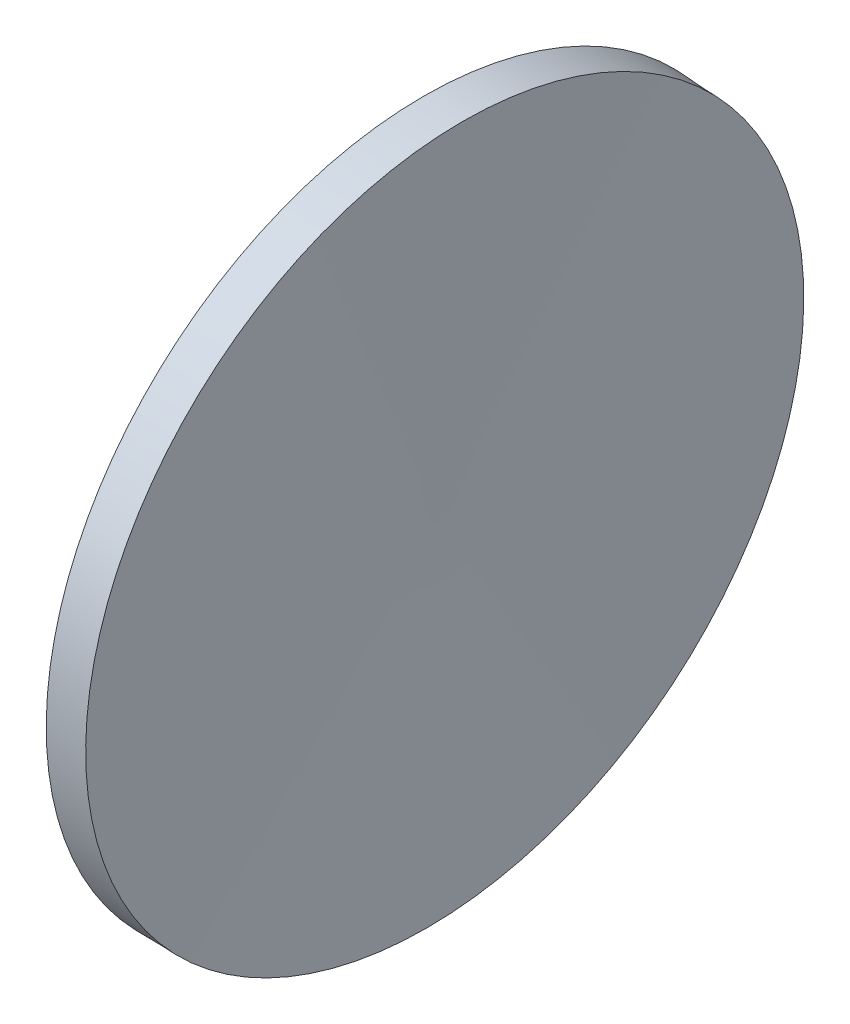
from build123d import *


with BuildPart() as part:
    # 草图1 → 旋转1 (revolve)
    with BuildSketch(Plane.XY):
        with BuildLine():
            Line((-115.589360424, 0.247109473), (-115.056821335, 0.220545144))
            Line((-115.056821335, 0.220545144), (-114.936765037, 2.068962975))
            Line((-114.936765037, 2.068962975), (-115.137397203, 2.081994204))
            ThreePointArc((-115.137397203, 2.081994204), (-115.451571227, 1.186275125), (-115.589360424, 0.247109473))
        make_face()
    revolve(axis=Axis((-115.589360424, 0.247109473, 0), (0.9987581899180289, -0.04982045836463798, 0)))


solid = part.part
